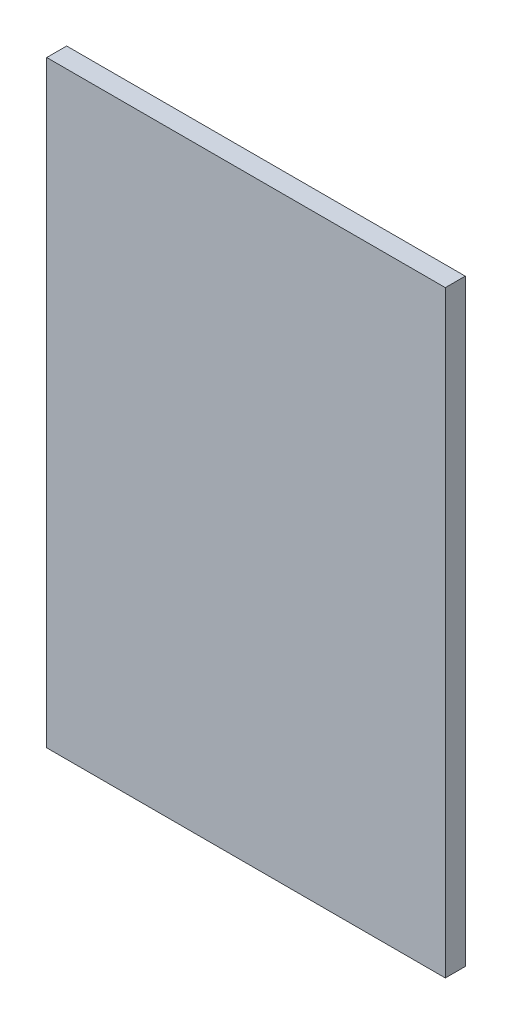
from build123d import *

# Parameters (mm, degrees)
SKETCH_1_W  = 40
SKETCH_1_H  = 60
F_2MM_DEPTH = 2


with BuildPart() as part:
    # 草图1 → 飞控减振垫_2mm占位 (new body)
    with BuildSketch(Plane.XY):
        Rectangle(SKETCH_1_W, SKETCH_1_H)
    extrude(amount=F_2MM_DEPTH)


solid = part.part
